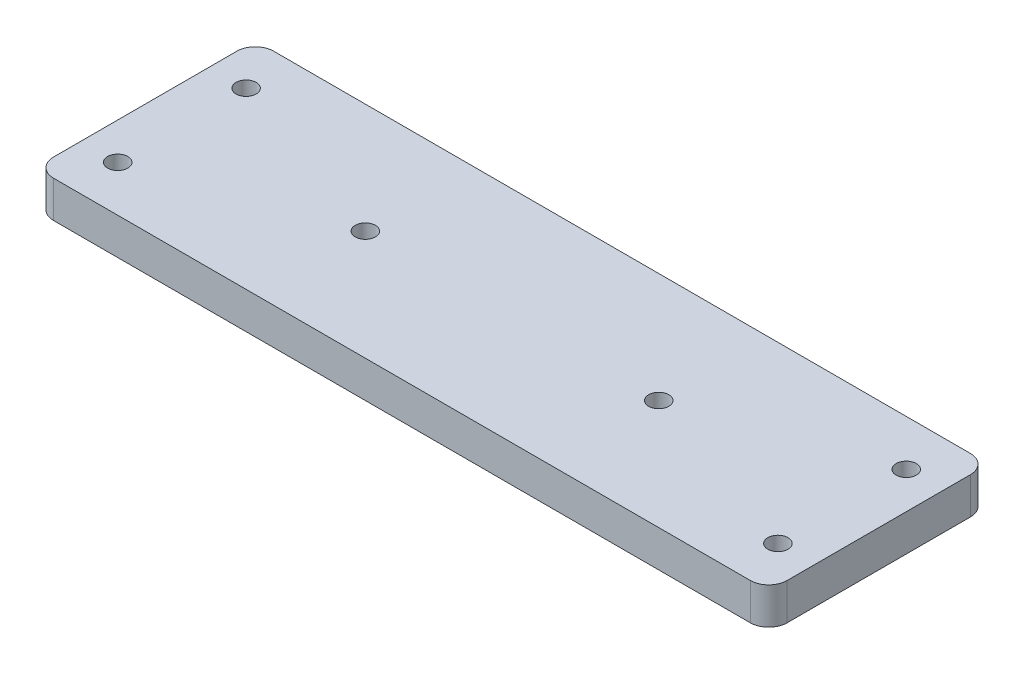
from build123d import *

# Parameters (mm, degrees)
SKETCH1_R           = 2.75
BOSS_EXTRUDE1_DEPTH = 10


with BuildPart() as part:
    # Sketch1 → Boss-Extrude1 (new body)
    with BuildSketch(Plane(origin=(0, 0, 0), x_dir=(1, 0, 0), z_dir=(0, 1, 0))):
        with BuildLine():
            Line((-95, -30), (95, -30))
            ThreePointArc((95, -30), (98.535533906, -28.535533906), (100, -25))
            Line((100, -25), (100, 25))
            ThreePointArc((100, 25), (98.535533906, 28.535533906), (95, 30))
            Line((95, 30), (-95, 30))
            ThreePointArc((-95, 30), (-98.535533906, 28.535533906), (-100, 25))
            Line((-100, 25), (-100, -25))
            ThreePointArc((-100, -25), (-98.535533906, -28.535533906), (-95, -30))
        make_face()
        with Locations(Location((-90, 17.5, 0), (0, 0, 270))):
            Circle(SKETCH1_R, mode=Mode.SUBTRACT)
        with Locations(Location((-90, -17.5, 0), (0, 0, 270))):
            Circle(SKETCH1_R, mode=Mode.SUBTRACT)
        with Locations(Location((90, 17.5, 0), (0, 0, 270))):
            Circle(SKETCH1_R, mode=Mode.SUBTRACT)
        with Locations(Location((90, -17.5, 0), (0, 0, 270))):
            Circle(SKETCH1_R, mode=Mode.SUBTRACT)
        with Locations(Location((-40, 0, 0), (0, 0, 270))):
            Circle(SKETCH1_R, mode=Mode.SUBTRACT)
        with Locations(Location((40, 0, 0), (0, 0, 270))):
            Circle(SKETCH1_R, mode=Mode.SUBTRACT)
    extrude(amount=BOSS_EXTRUDE1_DEPTH)


solid = part.part
